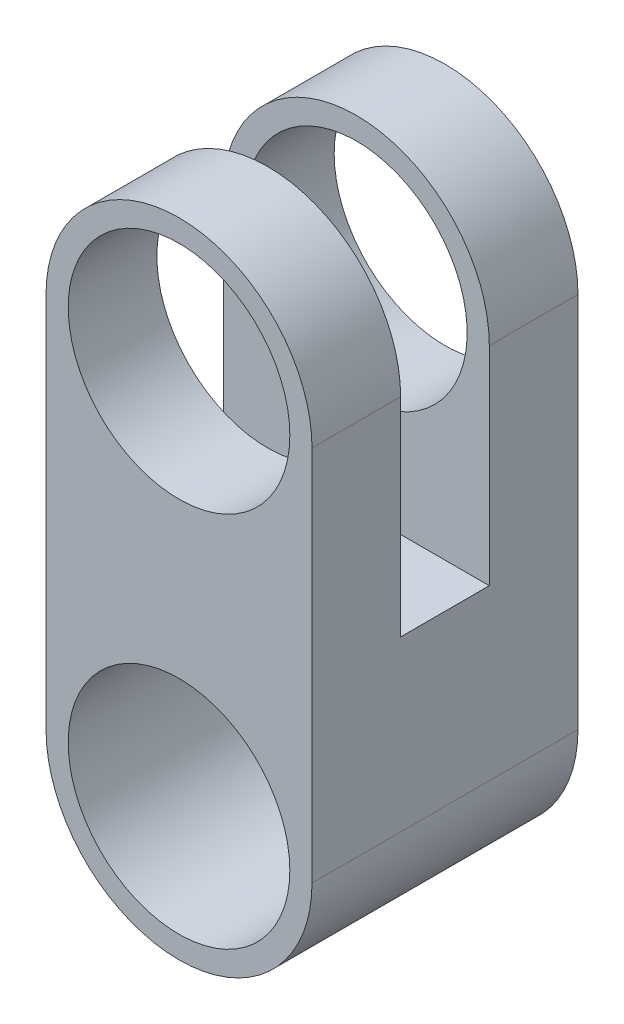
from build123d import *

# Parameters (mm, degrees)
SKETCH1_R           = 2.5
BOSS_EXTRUDE1_DEPTH = 6
CUT_EXTRUDE2_DEPTH  = 41.954878106


with BuildPart() as part:
    # Sketch1 → Boss-Extrude1 (new body)
    with BuildSketch(Plane.XY):
        with BuildLine():
            Line((3, 37.066220694), (3, 28.566220694))
            ThreePointArc((3, 28.566220694), (0, 25.566220694), (-3, 28.566220694))
            Line((-3, 28.566220694), (-3, 37.066220694))
            ThreePointArc((-3, 37.066220694), (0, 40.066220694), (3, 37.066220694))
        make_face()
        with Locations((0, 37.066220694)):
            Circle(SKETCH1_R, mode=Mode.SUBTRACT)
        with Locations((0, 28.566220694)):
            Circle(SKETCH1_R, mode=Mode.SUBTRACT)
    extrude(amount=BOSS_EXTRUDE1_DEPTH)

    # Sketch2 → Cut-Extrude2 (cut, through all)
    with BuildSketch(Plane.ZY.offset(3)):
        Polygon((2, 37.066220694), (2, 41.792397486), (4, 41.792397486), (4, 37.066220694), (4, 32.376323295), (2, 32.376323295), align=None)
    extrude(amount=-CUT_EXTRUDE2_DEPTH, mode=Mode.SUBTRACT)


solid = part.part
